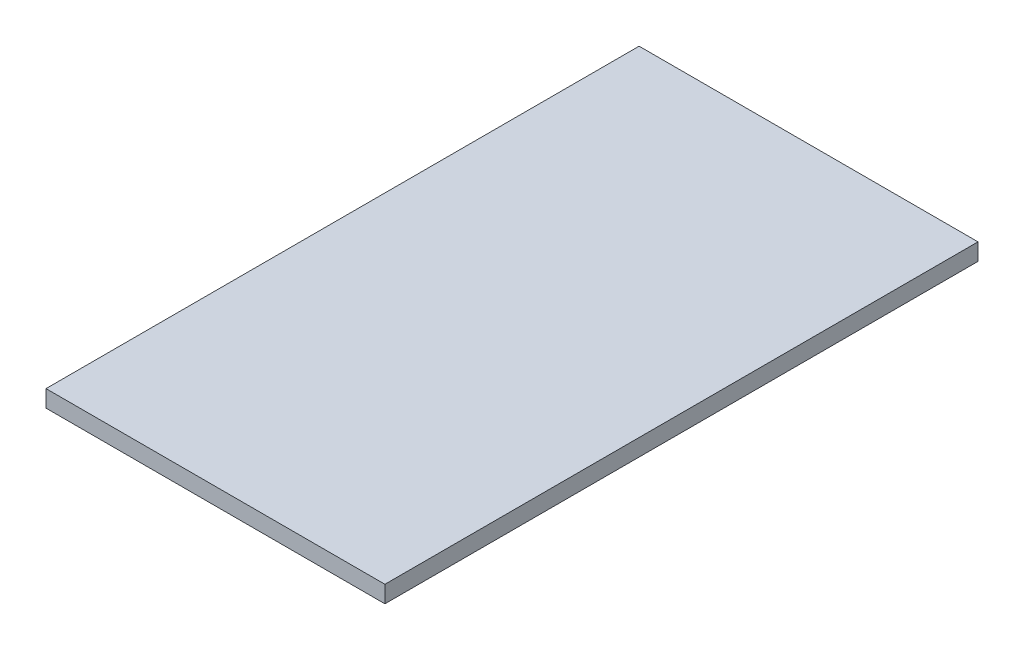
from build123d import *

# Parameters (mm, degrees)
SKETCH_1_W      = 200
SKETCH_1_H      = 350
EXTRUDE_1_DEPTH = 10


with BuildPart() as part:
    # Эскиз1 → Бобышка-Вытянуть1 (new body)
    with BuildSketch(Plane(origin=(0, 0, 0), x_dir=(1, 0, 0), z_dir=(0, 1, 0))):
        with Locations((100, 175)):
            Rectangle(SKETCH_1_W, SKETCH_1_H)
    extrude(amount=EXTRUDE_1_DEPTH)


solid = part.part
